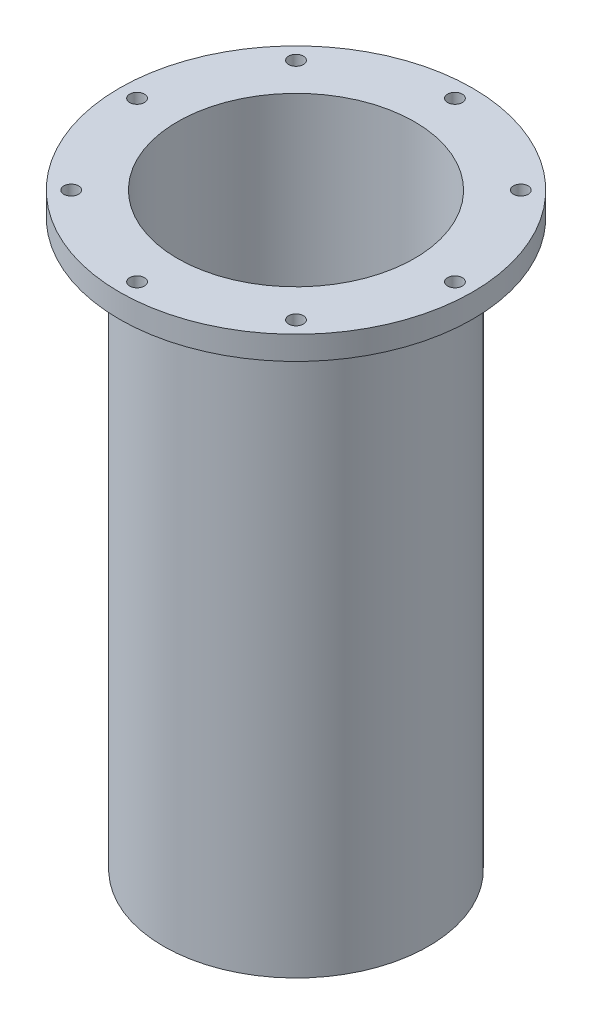
from build123d import *

# Parameters (mm, degrees)
BOLT_HOLES_PROFILE_R = 3.175
BOLT_HOLES_DEPTH     = 276.914624476


with BuildPart() as part:
    # Shell Profile → Shell Revolve (revolve)
    with BuildSketch(Plane.XY, mode=Mode.PRIVATE) as shell_revolve_sk:
        Polygon((51.1302, 0), (51.1302, 254), (76.2, 254), (76.2, 243.84), (57.15, 243.84), (57.15, 0), align=None)
    revolve(shell_revolve_sk.sketch.rotate(Axis((0, 0, 0), (0, -1, 0)), 90), axis=Axis((0, 0, 0), (0, -1, 0)))

    # Bolt Holes Profile → Bolt Holes (cut, through all)
    with BuildSketch(Plane(origin=(0, 254, 0), x_dir=(1, 0, 0), z_dir=(0, 1, 0))):
        with Locations(Location((0, 68.58, 0), (0, 0, 270))):
            Circle(BOLT_HOLES_PROFILE_R)
        with Locations(Location((48.493383054, 48.493383054, 0), (0, 0, 270))):
            Circle(BOLT_HOLES_PROFILE_R)
        with Locations(Location((68.58, 0, 0), (0, 0, 270))):
            Circle(BOLT_HOLES_PROFILE_R)
        with Locations(Location((48.493383054, -48.493383054, 0), (0, 0, 270))):
            Circle(BOLT_HOLES_PROFILE_R)
        with Locations(Location((0, -68.58, 0), (0, 0, 270))):
            Circle(BOLT_HOLES_PROFILE_R)
        with Locations(Location((-48.493383054, -48.493383054, 0), (0, 0, 270))):
            Circle(BOLT_HOLES_PROFILE_R)
        with Locations(Location((-68.58, 0, 0), (0, 0, 270))):
            Circle(BOLT_HOLES_PROFILE_R)
        with Locations(Location((-48.493383054, 48.493383054, 0), (0, 0, 270))):
            Circle(BOLT_HOLES_PROFILE_R)
    extrude(amount=-BOLT_HOLES_DEPTH, mode=Mode.SUBTRACT)


solid = part.part
